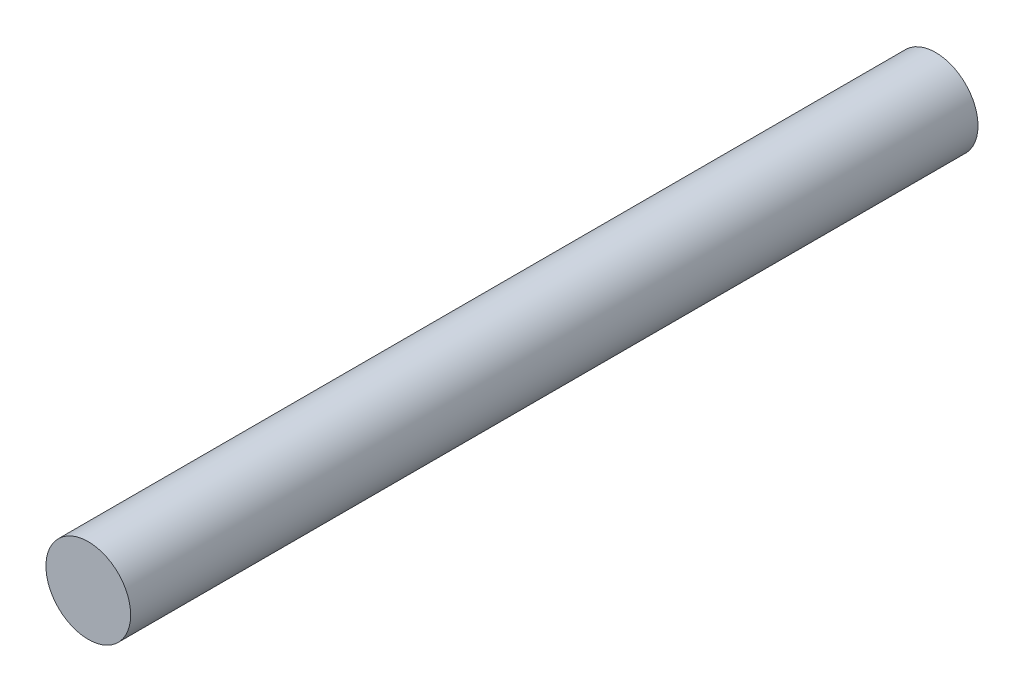
from build123d import *

# Parameters (mm, degrees)
SKETCH_1_R      = 5
EXTRUDE_1_DEPTH = 100


with BuildPart() as part:
    # 草图1 → 凸台-拉伸1 (new body)
    with BuildSketch(Plane.XY):
        Circle(SKETCH_1_R)
    extrude(amount=EXTRUDE_1_DEPTH)


solid = part.part
